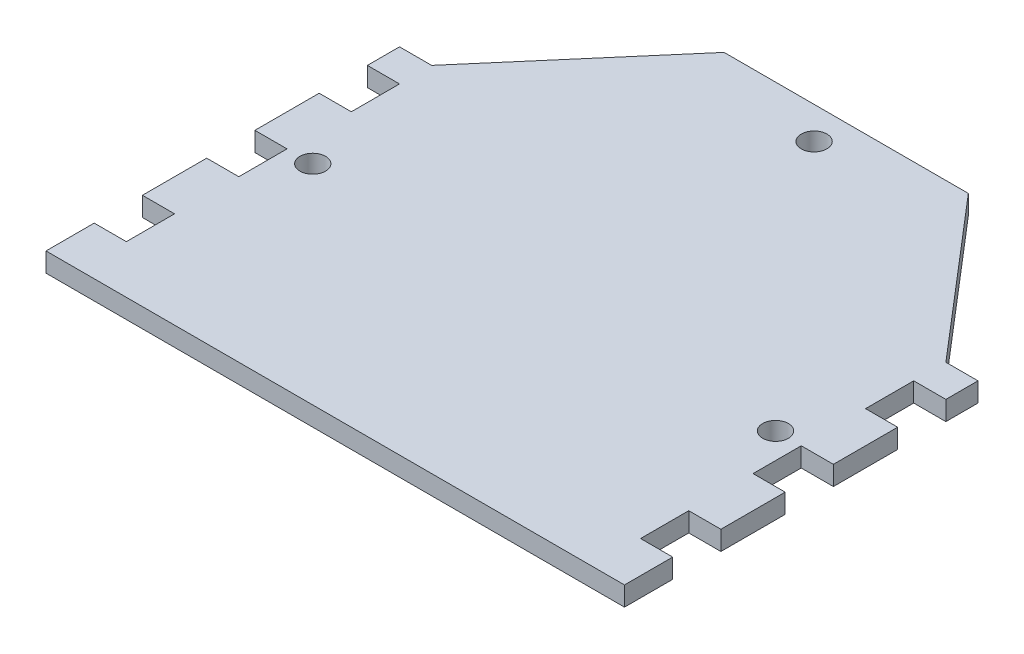
from build123d import *

# Parameters (mm, degrees)
SKETCH1_R           = 2
BOSS_EXTRUDE1_DEPTH = 3


with BuildPart() as part:
    # Sketch1 → Boss-Extrude1 (new body)
    with BuildSketch(Plane(origin=(0, 0, 0), x_dir=(1, 0, 0), z_dir=(0, 1, 0))):
        Polygon((-19, 35), (-40, 10.5), (-45, 10.5), (-45, 5.5), (-40, 5.5), (-40, -2), (-45, -2), (-45, -12), (-40, -12), (-40, -19.5), (-45, -19.5), (-45, -29.5), (-40, -29.5), (-40, -37), (-45, -37), (-45, -44.5), (-40, -44.5), (40, -44.5), (45, -44.5), (45, -37), (40, -37), (40, -29.5), (45, -29.5), (45, -19.5), (40, -19.5), (40, -12), (45, -12), (45, -2), (40, -2), (40, 5.5), (45, 5.5), (45, 10.5), (40, 10.5), (19, 35), align=None)
        with Locations(Location((-36, -12, 0), (0, 0, 270))):
            Circle(SKETCH1_R, mode=Mode.SUBTRACT)
        with Locations(Location((36, -12, 0), (0, 0, 270))):
            Circle(SKETCH1_R, mode=Mode.SUBTRACT)
        with Locations(Location((0, 30, 0), (0, 0, 270))):
            Circle(SKETCH1_R, mode=Mode.SUBTRACT)
    extrude(amount=BOSS_EXTRUDE1_DEPTH)


solid = part.part
